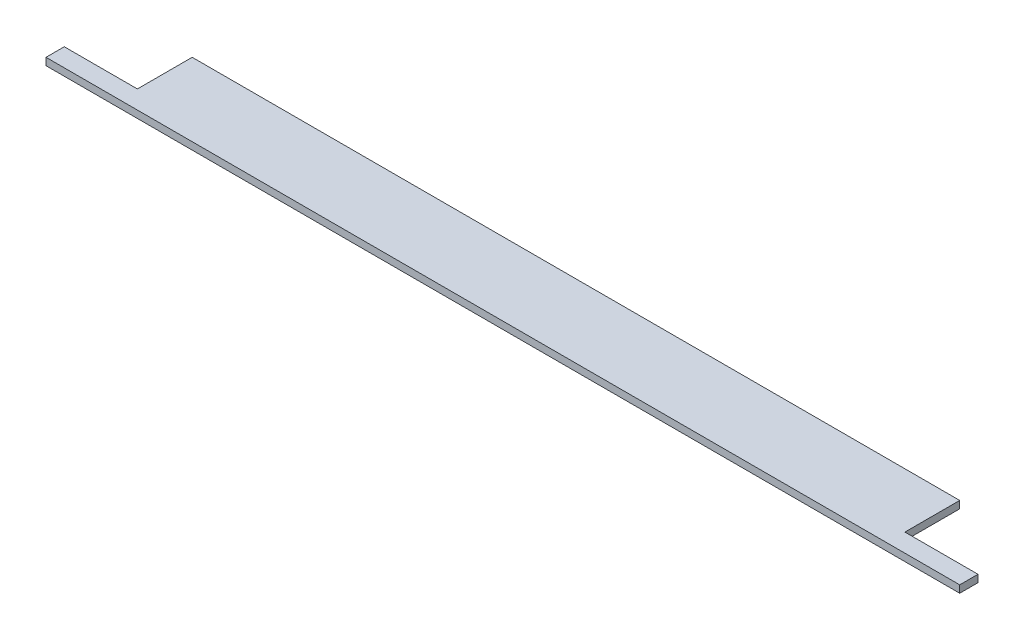
from build123d import *

# Parameters (mm, degrees)
SKETCH_1_W          = 500
SKETCH_1_H          = 40
EXTRUDE_1_DEPTH     = 4
SKETCH_3_W          = 40
SKETCH_3_H          = 30
CUT_EXTRUDE_1_DEPTH = 502.61339695
SKETCH_4_W          = 40
SKETCH_4_H          = 30
CUT_EXTRUDE_2_DEPTH = 502.61339695


with BuildPart() as part:
    # Эскиз1 → Бобышка-Вытянуть1 (new body)
    with BuildSketch(Plane(origin=(0, 0, 0), x_dir=(1, 0, 0), z_dir=(0, 1, 0))):
        with Locations((250, 20)):
            Rectangle(SKETCH_1_W, SKETCH_1_H)
    extrude(amount=EXTRUDE_1_DEPTH)

    # Эскиз3 → Вырез-Вытянуть1 (cut, through all)
    with BuildSketch(Plane(origin=(0, 4, 0), x_dir=(1, 0, 0), z_dir=(0, 1, 0))):
        with Locations((20, 25)):
            Rectangle(SKETCH_3_W, SKETCH_3_H)
    extrude(amount=-CUT_EXTRUDE_1_DEPTH, mode=Mode.SUBTRACT)

    # Эскиз4 → Вырез-Вытянуть2 (cut, through all)
    with BuildSketch(Plane(origin=(0, 4, 0), x_dir=(1, 0, 0), z_dir=(0, 1, 0))):
        with Locations((480, 25)):
            Rectangle(SKETCH_4_W, SKETCH_4_H)
    extrude(amount=-CUT_EXTRUDE_2_DEPTH, mode=Mode.SUBTRACT)


solid = part.part
